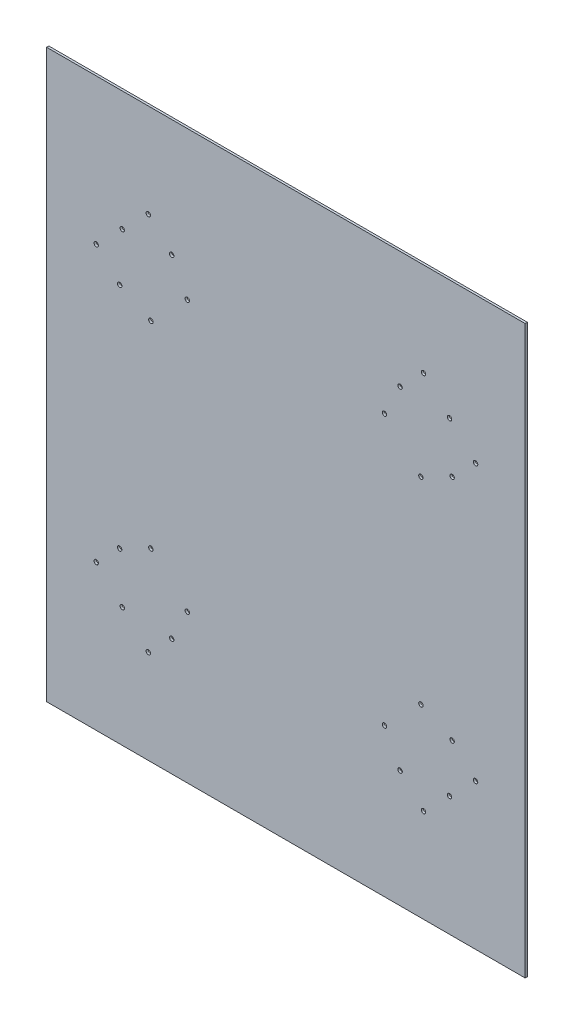
from build123d import *

# Parameters (mm, degrees)
SKETCH1_W           = 650
SKETCH1_H           = 770
SKETCH1_R           = 3
BOSS_EXTRUDE2_DEPTH = 3


with BuildPart() as part:
    # Sketch1 → Boss-Extrude2 (new body)
    with BuildSketch(Plane.XY):
        with Locations((1065.777273447, -1504.227226955)):
            Rectangle(SKETCH1_W, SKETCH1_H)
        with Locations((1288.091645453, -1281.91285495)):
            Circle(SKETCH1_R, mode=Mode.SUBTRACT)
        with Locations((843.462901442, -1726.54159896)):
            Circle(SKETCH1_R, mode=Mode.SUBTRACT)
        with Locations((931.851249091, -1687.650725995)):
            Circle(SKETCH1_R, mode=Mode.SUBTRACT)
        with Locations((910.638045655, -1730.077132866)):
            Circle(SKETCH1_R, mode=Mode.SUBTRACT)
        with Locations((878.818240502, -1761.896938019)):
            Circle(SKETCH1_R, mode=Mode.SUBTRACT)
        with Locations((1323.446984512, -1317.268194009)):
            Circle(SKETCH1_R, mode=Mode.SUBTRACT)
        with Locations((1249.200772487, -1370.301202598)):
            Circle(SKETCH1_R, mode=Mode.SUBTRACT)
        with Locations((1291.627179358, -1349.087999163)):
            Circle(SKETCH1_R, mode=Mode.SUBTRACT)
        with Locations((1220.91650124, -1278.377321044)):
            Circle(SKETCH1_R, mode=Mode.SUBTRACT)
        with Locations((1199.703297804, -1320.803727915)):
            Circle(SKETCH1_R, mode=Mode.SUBTRACT)
        with Locations((1252.736306393, -1246.55751589)):
            Circle(SKETCH1_R, mode=Mode.SUBTRACT)
        with Locations((882.353774408, -1638.153251312)):
            Circle(SKETCH1_R, mode=Mode.SUBTRACT)
        with Locations((808.107562383, -1691.186259901)):
            Circle(SKETCH1_R, mode=Mode.SUBTRACT)
        with Locations((839.927367536, -1659.366454747)):
            Circle(SKETCH1_R, mode=Mode.SUBTRACT)
        with Locations((1291.627179358, -1659.366454747)):
            Circle(SKETCH1_R, mode=Mode.SUBTRACT)
        with Locations((1323.446984512, -1691.186259901)):
            Circle(SKETCH1_R, mode=Mode.SUBTRACT)
        with Locations((1288.091645453, -1726.54159896)):
            Circle(SKETCH1_R, mode=Mode.SUBTRACT)
        with Locations((1252.736306393, -1761.896938019)):
            Circle(SKETCH1_R, mode=Mode.SUBTRACT)
        with Locations((1220.91650124, -1730.077132866)):
            Circle(SKETCH1_R, mode=Mode.SUBTRACT)
        with Locations((1199.703297804, -1687.650725995)):
            Circle(SKETCH1_R, mode=Mode.SUBTRACT)
        with Locations((1249.200772487, -1638.153251312)):
            Circle(SKETCH1_R, mode=Mode.SUBTRACT)
        with Locations((839.927367536, -1349.087999163)):
            Circle(SKETCH1_R, mode=Mode.SUBTRACT)
        with Locations((808.107562383, -1317.268194009)):
            Circle(SKETCH1_R, mode=Mode.SUBTRACT)
        with Locations((843.462901442, -1281.91285495)):
            Circle(SKETCH1_R, mode=Mode.SUBTRACT)
        with Locations((878.818240502, -1246.55751589)):
            Circle(SKETCH1_R, mode=Mode.SUBTRACT)
        with Locations((910.638045655, -1278.377321044)):
            Circle(SKETCH1_R, mode=Mode.SUBTRACT)
        with Locations((931.851249091, -1320.803727915)):
            Circle(SKETCH1_R, mode=Mode.SUBTRACT)
        with Locations((882.353774408, -1370.301202598)):
            Circle(SKETCH1_R, mode=Mode.SUBTRACT)
    extrude(amount=BOSS_EXTRUDE2_DEPTH)


solid = part.part
